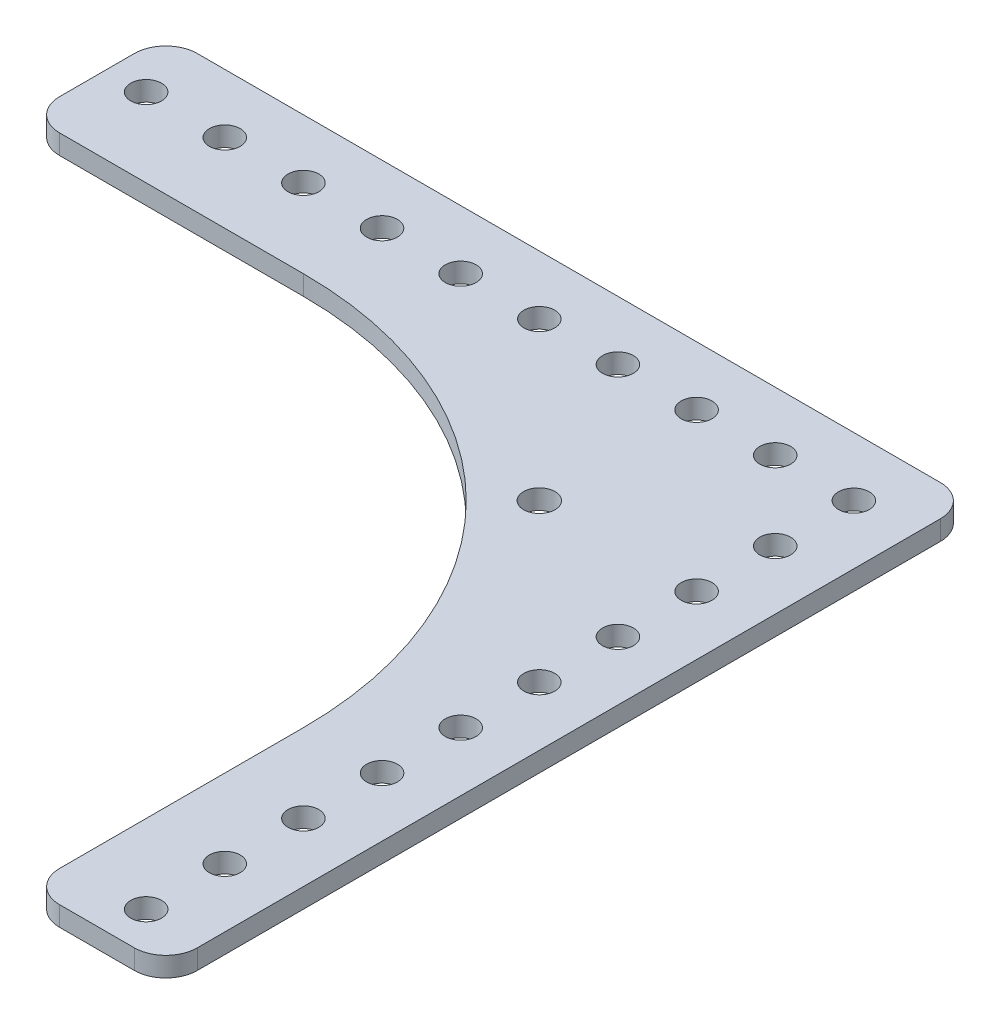
from build123d import *

# Parameters (mm, degrees)
SKETCH1_R           = 2.4892
SKETCH1_R_2         = 2.54
BOSS_EXTRUDE1_DEPTH = 3.175
BOSS_EXTRUDE2_START = -3.175
SKETCH3_R           = 2.4892
BOSS_EXTRUDE2_DEPTH = 3.175
SKETCH4_R           = 2.4892
CUT_EXTRUDE1_DEPTH  = 122.275025768


with BuildPart() as part:
    # Sketch1 → Boss-Extrude1 (new body)
    with BuildSketch(Plane(origin=(0, 0, 0), x_dir=(1, 0, 0), z_dir=(0, 1, 0))):
        with BuildLine():
            Line((0, 63.5), (-33.02, 63.5))
            ThreePointArc((-33.02, 63.5), (-36.612102448, 64.987897552), (-38.1, 68.58))
            Line((-38.1, 68.58), (-38.1, 77.47))
            ThreePointArc((-38.1, 77.47), (-36.612102448, 81.062102448), (-33.02, 82.55))
            Line((-33.02, 82.55), (77.47, 82.55))
            ThreePointArc((77.47, 82.55), (81.062102448, 81.062102448), (82.55, 77.47))
            Line((82.55, 77.47), (82.55, -33.02))
            ThreePointArc((82.55, -33.02), (81.062102448, -36.612102448), (77.47, -38.1))
            Line((77.47, -38.1), (68.58, -38.1))
            ThreePointArc((68.58, -38.1), (64.987897552, -36.612102448), (63.5, -33.02))
            Line((63.5, -33.02), (63.5, 0))
            ThreePointArc((63.5, 0), (44.901280605, 44.901280605), (0, 63.5))
        make_face()
        with Locations(Location((-28.575, 73.025, 0), (0, 0, 270))):
            Circle(SKETCH1_R, mode=Mode.SUBTRACT)
        with Locations(Location((-15.875, 73.025, 0), (0, 0, 270))):
            Circle(SKETCH1_R, mode=Mode.SUBTRACT)
        with Locations(Location((-3.175, 73.025, 0), (0, 0, 270))):
            Circle(SKETCH1_R, mode=Mode.SUBTRACT)
        with Locations(Location((9.525, 73.025, 0), (0, 0, 270))):
            Circle(SKETCH1_R, mode=Mode.SUBTRACT)
        with Locations(Location((22.225, 73.025, 0), (0, 0, 270))):
            Circle(SKETCH1_R, mode=Mode.SUBTRACT)
        with Locations(Location((34.925, 73.025, 0), (0, 0, 270))):
            Circle(SKETCH1_R, mode=Mode.SUBTRACT)
        with Locations(Location((47.625, 73.025, 0), (0, 0, 270))):
            Circle(SKETCH1_R, mode=Mode.SUBTRACT)
        with Locations(Location((60.325, 73.025, 0), (0, 0, 270))):
            Circle(SKETCH1_R, mode=Mode.SUBTRACT)
        with Locations(Location((73.025, 73.025, 0), (0, 0, 270))):
            Circle(SKETCH1_R, mode=Mode.SUBTRACT)
        with Locations(Location((73.025, 60.325, 0), (0, 0, 270))):
            Circle(SKETCH1_R, mode=Mode.SUBTRACT)
        with Locations(Location((73.025, 47.625, 0), (0, 0, 270))):
            Circle(SKETCH1_R, mode=Mode.SUBTRACT)
        with Locations(Location((73.025, 34.925, 0), (0, 0, 270))):
            Circle(SKETCH1_R, mode=Mode.SUBTRACT)
        with Locations(Location((73.025, 22.225, 0), (0, 0, 270))):
            Circle(SKETCH1_R, mode=Mode.SUBTRACT)
        with Locations(Location((73.025, 9.525, 0), (0, 0, 270))):
            Circle(SKETCH1_R, mode=Mode.SUBTRACT)
        with Locations(Location((73.025, -3.175, 0), (0, 0, 270))):
            Circle(SKETCH1_R, mode=Mode.SUBTRACT)
        with Locations(Location((73.025, -15.875, 0), (0, 0, 270))):
            Circle(SKETCH1_R, mode=Mode.SUBTRACT)
        with Locations(Location((73.025, -28.575, 0), (0, 0, 270))):
            Circle(SKETCH1_R, mode=Mode.SUBTRACT)
        with Locations(Location((50.8, 50.8, 0), (0, 0, 270))):
            Circle(SKETCH1_R_2, mode=Mode.SUBTRACT)
    extrude(amount=BOSS_EXTRUDE1_DEPTH)

    # Sketch3 → Boss-Extrude2 (add)
    with BuildSketch(Plane(origin=(0, 3.175, 0), x_dir=(1, 0, 0), z_dir=(0, 1, 0)).offset(BOSS_EXTRUDE2_START)):
        with BuildLine():
            ThreePointArc((-33.02, 63.5), (-35.859806331, 64.367886516), (-37.729286039, 66.675))
            ThreePointArc((-37.729286039, 66.675), (-38.006460322, 67.609632307), (-38.1, 68.58))
            Line((-38.1, 68.58), (-38.1, 77.47))
            ThreePointArc((-38.1, 77.47), (-36.612102448, 81.062102448), (-33.02, 82.55))
            Line((-33.02, 82.55), (77.47, 82.55))
            ThreePointArc((77.47, 82.55), (81.062102448, 81.062102448), (82.55, 77.47))
            Line((82.55, 77.47), (82.55, -33.02))
            ThreePointArc((82.55, -33.02), (81.062102448, -36.612102448), (77.47, -38.1))
            Line((77.47, -38.1), (68.58, -38.1))
            ThreePointArc((68.58, -38.1), (67.609632307, -38.006460322), (66.675, -37.729286039))
            ThreePointArc((66.675, -37.729286039), (64.367886516, -35.859806331), (63.5, -33.02))
            Line((63.5, -33.02), (63.5, -39.37))
            ThreePointArc((63.5, -39.37), (64.987897552, -42.962102448), (68.58, -44.45))
            Line((68.58, -44.45), (80.645, -44.45))
            ThreePointArc((80.645, -44.45), (84.237102448, -42.962102448), (85.725, -39.37))
            Line((85.725, -39.37), (85.725, 80.645))
            ThreePointArc((85.725, 80.645), (84.237102448, 84.237102448), (80.645, 85.725))
            Line((80.645, 85.725), (-39.37, 85.725))
            ThreePointArc((-39.37, 85.725), (-42.962102448, 84.237102448), (-44.45, 80.645))
            Line((-44.45, 80.645), (-44.45, 68.58))
            ThreePointArc((-44.45, 68.58), (-42.962102448, 64.987897552), (-39.37, 63.5))
            Line((-39.37, 63.5), (-33.02, 63.5))
        make_face()
        with Locations((73.025, -28.575)):
            Circle(SKETCH3_R)
        with Locations((73.025, -15.875)):
            Circle(SKETCH3_R)
        with Locations((73.025, -3.175)):
            Circle(SKETCH3_R)
        with Locations((73.025, 9.525)):
            Circle(SKETCH3_R)
        with Locations((73.025, 22.225)):
            Circle(SKETCH3_R)
        with Locations((73.025, 34.925)):
            Circle(SKETCH3_R)
        with Locations((73.025, 47.625)):
            Circle(SKETCH3_R)
        with Locations((73.025, 60.325)):
            Circle(SKETCH3_R)
        with Locations((73.025, 73.025)):
            Circle(SKETCH3_R)
        with Locations((60.325, 73.025)):
            Circle(SKETCH3_R)
        with Locations((47.625, 73.025)):
            Circle(SKETCH3_R)
        with Locations((34.925, 73.025)):
            Circle(SKETCH3_R)
        with Locations((22.225, 73.025)):
            Circle(SKETCH3_R)
        with Locations((9.525, 73.025)):
            Circle(SKETCH3_R)
        with Locations((-3.175, 73.025)):
            Circle(SKETCH3_R)
        with Locations((-15.875, 73.025)):
            Circle(SKETCH3_R)
        with Locations((-28.575, 73.025)):
            Circle(SKETCH3_R)
    extrude(amount=BOSS_EXTRUDE2_DEPTH)

    # Sketch4 → Cut-Extrude1 (cut, through all)
    with BuildSketch(Plane(origin=(0, 3.175, 0), x_dir=(1, 0, 0), z_dir=(0, 1, 0))):
        with Locations(Location((63.5, 76.2, 0), (0, 0, 270))):
            Circle(SKETCH4_R)
        with Locations(Location((76.2, 76.2, 0), (0, 0, 270))):
            Circle(SKETCH4_R)
        with Locations(Location((76.2, 63.5, 0), (0, 0, 270))):
            Circle(SKETCH4_R)
        with Locations(Location((76.2, 50.8, 0), (0, 0, 270))):
            Circle(SKETCH4_R)
        with Locations(Location((76.2, 38.1, 0), (0, 0, 270))):
            Circle(SKETCH4_R)
        with Locations(Location((50.8, 76.2, 0), (0, 0, 270))):
            Circle(SKETCH4_R)
        with Locations(Location((38.1, 76.2, 0), (0, 0, 270))):
            Circle(SKETCH4_R)
        with Locations(Location((25.4, 76.2, 0), (0, 0, 270))):
            Circle(SKETCH4_R)
        with Locations(Location((76.2, -25.4, 0), (0, 0, 270))):
            Circle(SKETCH4_R)
        with Locations(Location((76.2, -12.7, 0), (0, 0, 270))):
            Circle(SKETCH4_R)
        with Locations(Location((76.2, 0, 0), (0, 0, 270))):
            Circle(SKETCH4_R)
        with Locations(Location((76.2, 12.7, 0), (0, 0, 270))):
            Circle(SKETCH4_R)
        with Locations(Location((76.2, 25.4, 0), (0, 0, 270))):
            Circle(SKETCH4_R)
        with Locations(Location((12.7, 76.2, 0), (0, 0, 270))):
            Circle(SKETCH4_R)
        with Locations(Location((0, 76.2, 0), (0, 0, 270))):
            Circle(SKETCH4_R)
        with Locations(Location((-12.7, 76.2, 0), (0, 0, 270))):
            Circle(SKETCH4_R)
        with Locations(Location((-38.1, 76.2, 0), (0, 0, 270))):
            Circle(SKETCH4_R)
        with Locations(Location((-25.4, 76.2, 0), (0, 0, 270))):
            Circle(SKETCH4_R)
        with Locations(Location((76.2, -38.1, 0), (0, 0, 270))):
            Circle(SKETCH4_R)
    extrude(amount=-CUT_EXTRUDE1_DEPTH, mode=Mode.SUBTRACT)


solid = part.part
